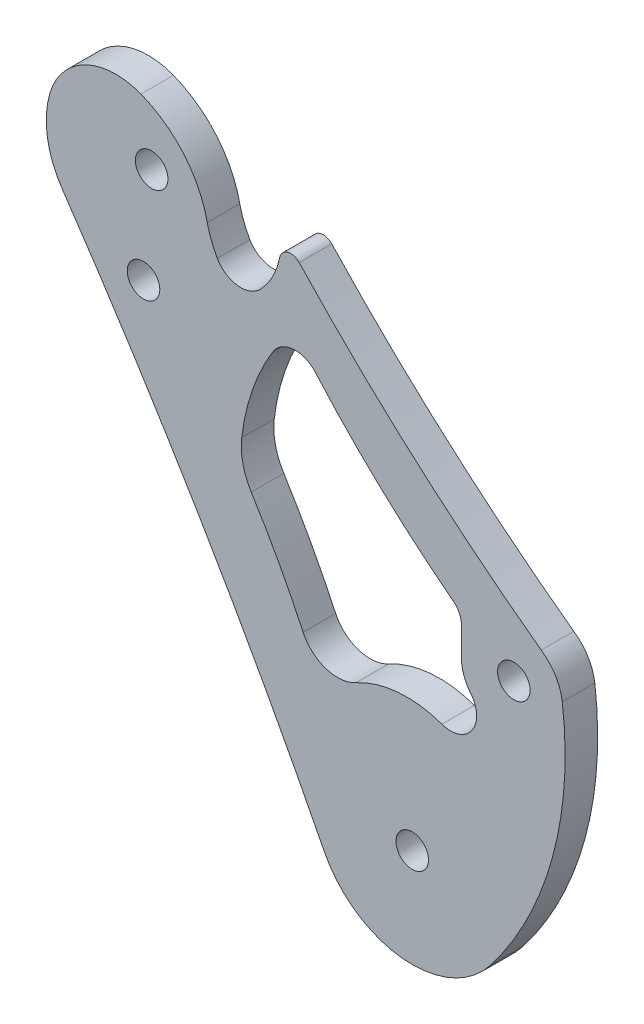
from build123d import *

# Parameters (mm, degrees)
ESQUISSE1_R        = 1.5
ESQUISSE1_R_2      = 1.50110642
BOSS_EXTRU_1_DEPTH = 3


with BuildPart() as part:
    # Esquisse1 → Boss.-Extru.1 (new body)
    with BuildSketch(Plane.XY):
        with BuildLine():
            ThreePointArc((60.026944648, 49.921558504), (72.778337749, 29.898863696), (84.195273994, 9.086369847))
            ThreePointArc((84.195273994, 9.086369847), (91.451273571, 4.140927091), (99.509067829, 7.630753106))
            ThreePointArc((99.509067829, 7.630753106), (105.251720368, 19.156706799), (106.145904128, 32.002955361))
            ThreePointArc((106.145904128, 32.002955361), (105.517176975, 33.787686969), (104.210334733, 35.15616353))
            ThreePointArc((104.210334733, 35.15616353), (92.58899703, 44.531440422), (81.889188019, 54.946112475))
            ThreePointArc((81.889188019, 54.946112475), (80.829609942, 55.239205413), (80.085451585, 54.429985101))
            ThreePointArc((80.085451585, 54.429985101), (79.43974416, 52.594599516), (78.30149473, 51.016636729))
            ThreePointArc((78.30149473, 51.016636729), (76.19777745, 50.272546762), (74.337717048, 51.505215238))
            ThreePointArc((74.337717048, 51.505215238), (73.781586954, 52.671085372), (73.412965229, 53.909088553))
            ThreePointArc((73.412965229, 53.909088553), (71.258227235, 58.277263879), (67.291581582, 61.103847288))
            ThreePointArc((67.291581582, 61.103847288), (62.173852637, 60.880940246), (58.891944342, 56.947758957))
            ThreePointArc((58.891944342, 56.947758957), (58.674610839, 53.307878055), (60.026944648, 49.921558504))
        make_face()
        with Locations((68.285467108, 55.560427953)):
            Circle(ESQUISSE1_R, mode=Mode.SUBTRACT)
        with Locations((101.682075096, 31.433543054)):
            Circle(ESQUISSE1_R, mode=Mode.SUBTRACT)
        with Locations((92.312371453, 13.200094295)):
            Circle(ESQUISSE1_R, mode=Mode.SUBTRACT)
        with Locations((67.535467108, 46.360427953)):
            Circle(ESQUISSE1_R_2, mode=Mode.SUBTRACT)
        with BuildLine():
            Line((96.849719723, 30.848999233), (96.849719723, 33.474650871))
            ThreePointArc((96.849719723, 33.474650871), (96.647309876, 34.343108764), (96.081794601, 35.032587793))
            ThreePointArc((96.081794601, 35.032587793), (89.436975045, 40.671042336), (83.372922141, 46.929880801))
            ThreePointArc((83.372922141, 46.929880801), (81.323140328, 47.752609653), (79.445810973, 46.588941858))
            ThreePointArc((79.445810973, 46.588941858), (77.571604785, 42.607109512), (76.591708968, 38.316720036))
            ThreePointArc((76.591708968, 38.316720036), (76.69683067, 36.288635677), (77.467153905, 34.409598995))
            ThreePointArc((77.467153905, 34.409598995), (79.992055499, 30.078906011), (82.254048976, 25.605270433))
            ThreePointArc((82.254048976, 25.605270433), (84.350090923, 23.753861276), (87.134236378, 24.017758597))
            ThreePointArc((87.134236378, 24.017758597), (91.023623533, 25.188476532), (95.051173024, 24.662398573))
            ThreePointArc((95.051173024, 24.662398573), (97.816197879, 25.543673578), (97.709238653, 28.443771474))
            ThreePointArc((97.709238653, 28.443771474), (97.07105369, 29.571903567), (96.849719723, 30.848999233))
        make_face(mode=Mode.SUBTRACT)
    extrude(amount=BOSS_EXTRU_1_DEPTH)


solid = part.part
